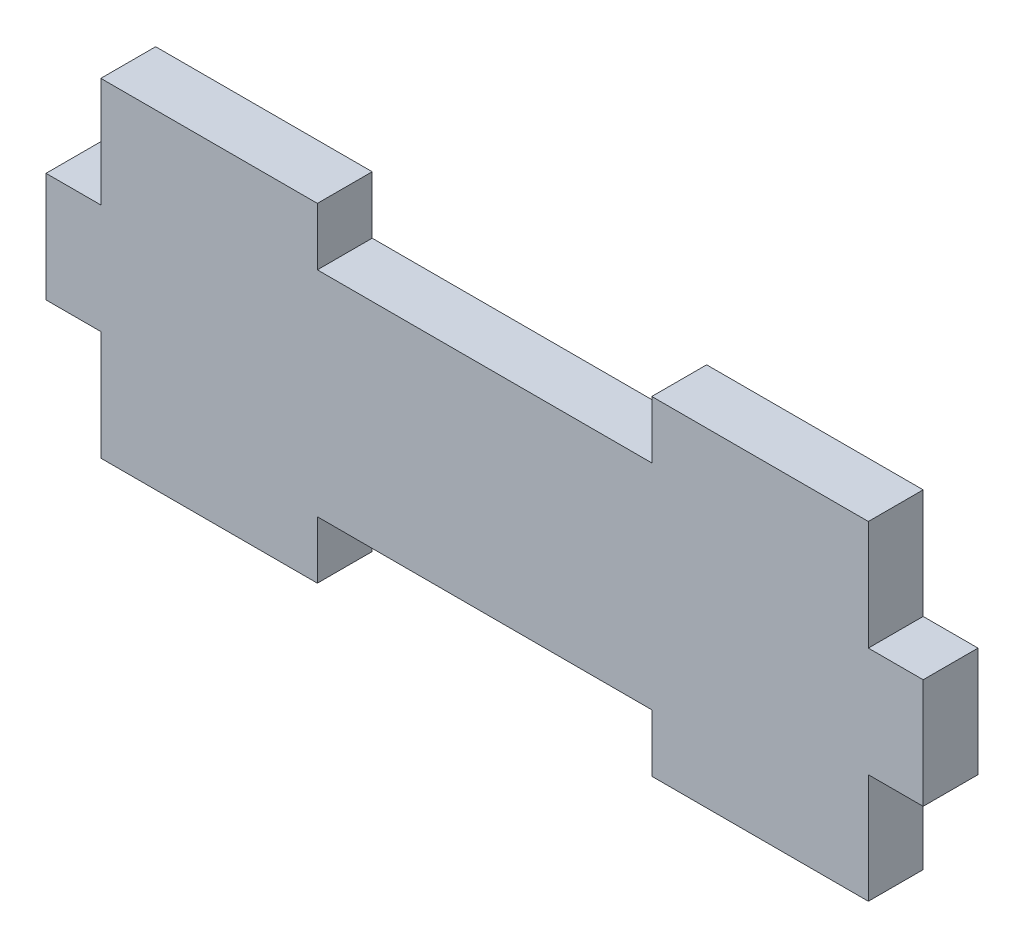
from build123d import *

# Parameters (mm, degrees)
BOSS_EXTRUDE1_DEPTH = 2.5


with BuildPart() as part:
    # Sketch2 → Boss-Extrude1 (new, symmetric)
    with BuildSketch(Plane.XY):
        Polygon((-161.502975542, -123.729086599), (-161.502975542, -128.979086599), (-131.002975542, -128.979086599), (-131.002975542, -123.729086599), (-111.252975542, -123.729086599), (-111.252975542, -133.729086599), (-106.252975542, -133.729086599), (-106.252975542, -143.729086599), (-111.252975542, -143.729086599), (-111.252975542, -153.729086599), (-131.002975542, -153.729086599), (-131.002975542, -148.479086599), (-161.502975542, -148.479086599), (-161.502975542, -153.729086599), (-181.252975542, -153.729086599), (-181.252975542, -143.729086599), (-186.252975542, -143.729086599), (-186.252975542, -133.729086599), (-181.252975542, -133.729086599), (-181.252975542, -123.729086599), align=None)
    extrude(amount=BOSS_EXTRUDE1_DEPTH, both=True)


solid = part.part
